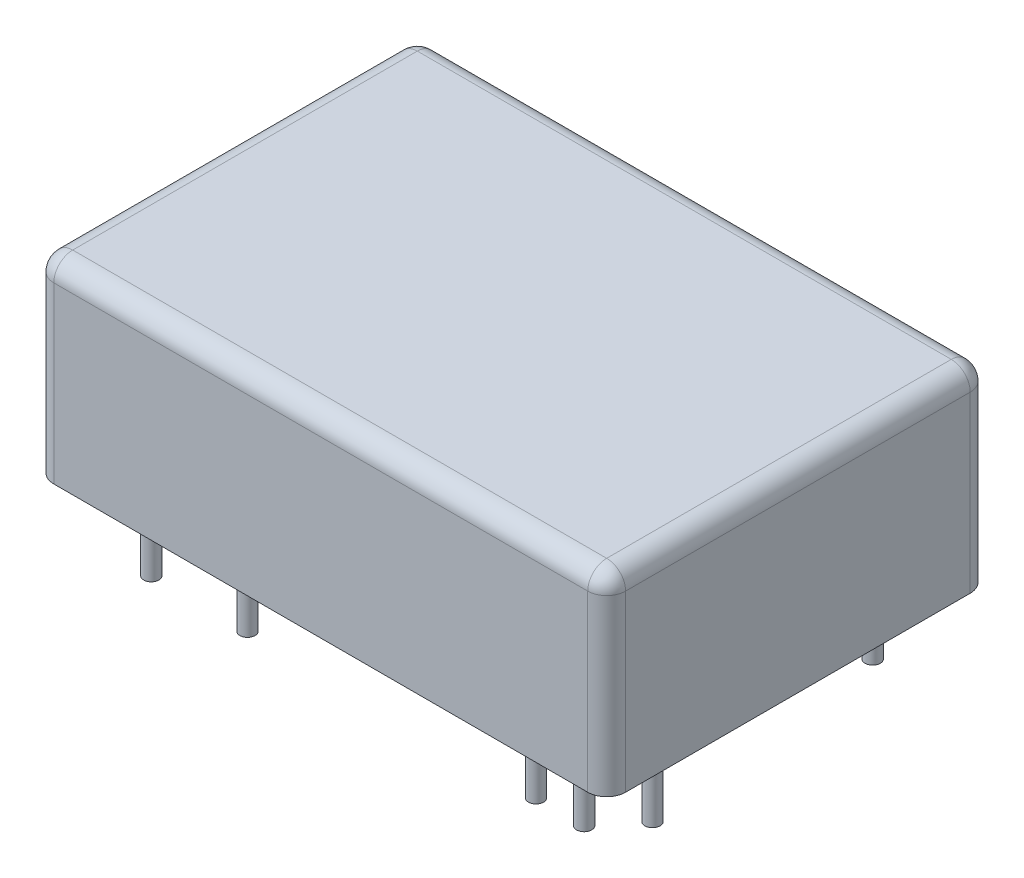
from build123d import *

# Parameters (mm, degrees)
SKETCH_1_W      = 30.2
SKETCH_1_H      = 20.2
EXTRUDE_1_DEPTH = 10.2
FILLET_1_R      = 1
SKETCH_2_R      = 0.4
EXTRUDE_3_DEPTH = 4


with BuildPart() as part:
    # Эскиз1 → Бобышка-Вытянуть1 (new body)
    with BuildSketch(Plane(origin=(0, 0, 0), x_dir=(1, 0, 0), z_dir=(0, 1, 0))):
        Rectangle(SKETCH_1_W, SKETCH_1_H)
    extrude(amount=EXTRUDE_1_DEPTH)

    # Скругление1
    fillet_1_edges = [part.edges().sort_by_distance(p)[0] for p in [
        (-15.1, 10.2, 0),
        (0, 10.2, 10.1),
        (15.1, 10.2, 0),
        (0, 10.2, -10.1),
        (15.1, 5.1, 10.1),
        (-15.1, 5.1, 10.1),
        (-15.1, 5.1, -10.1),
        (15.1, 5.1, -10.1),
    ]]
    fillet(fillet_1_edges, radius=FILLET_1_R)

    # Эскиз2 → Бобышка-Вытянуть3 (add)
    with BuildSketch(Plane.XZ):
        with Locations(Location((11.53, 7.72, 0), (0, 0, 90))):
            Circle(SKETCH_2_R)
        with Locations(Location((13.15, 5.73, 0), (0, 0, 90))):
            Circle(SKETCH_2_R)
        with Locations(Location((8.99, 7.72, 0), (0, 0, 90))):
            Circle(SKETCH_2_R)
        with Locations(Location((6.45, -7.52, 0), (0, 0, 90))):
            Circle(SKETCH_2_R)
        with Locations(Location((-6.25, 7.72, 0), (0, 0, 90))):
            Circle(SKETCH_2_R)
        with Locations(Location((-11.33, 7.72, 0), (0, 0, 90))):
            Circle(SKETCH_2_R)
        with Locations(Location((-11.33, -7.52, 0), (0, 0, 90))):
            Circle(SKETCH_2_R)
        with Locations(Location((-6.25, -7.52, 0), (0, 0, 90))):
            Circle(SKETCH_2_R)
        with Locations(Location((8.99, -7.52, 0), (0, 0, 90))):
            Circle(SKETCH_2_R)
        with Locations(Location((11.53, -7.52, 0), (0, 0, 90))):
            Circle(SKETCH_2_R)
    extrude(amount=EXTRUDE_3_DEPTH)


solid = part.part
